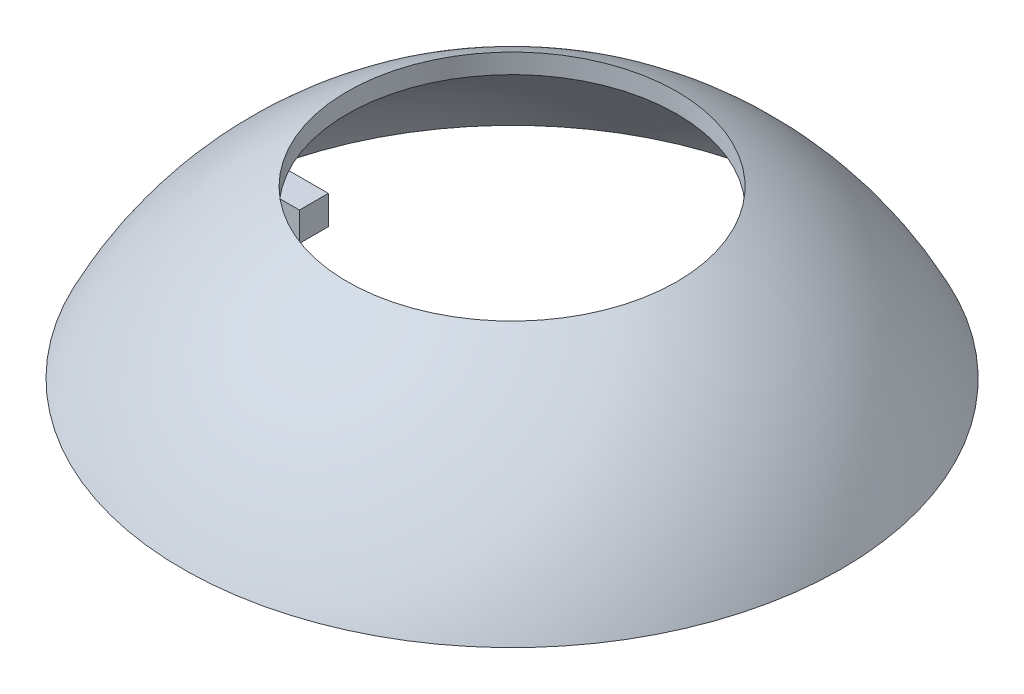
from build123d import *

# Parameters (mm, degrees)
SALIENTE_EXTRUIR1_DEPTH = 5


with BuildPart() as part:
    # Croquis2 → Revolución2 (revolve)
    with BuildSketch(Plane.XY):
        with BuildLine():
            Line((57, 27.986603938), (53.637673328, 27.986603938))
            ThreePointArc((53.637673328, 27.986603938), (42.984719481, 42.574216272), (28.5, 53.366656257))
            Line((28.5, 53.366656257), (28.5, 56.745043836))
            ThreePointArc((28.5, 56.745043836), (45.103486188, 44.698160294), (57, 27.986603938))
        make_face()
    revolve(axis=Axis((0, 10.058437275, 0), (0, 1, 0)))

    # Croquis3 → Saliente-Extruir1 (add)
    with BuildSketch(Plane.XZ.offset(-27.986603938)):
        with BuildLine():
            Line((38.630056924, 1.848931625), (49.379751122, 1.848931625))
            Line((49.379751122, 1.848931625), (49.379751122, -3.151068375))
            Line((49.379751122, -3.151068375), (38.630056924, -3.151068375))
            Line((38.630056924, -3.151068375), (38.630056924, -8.151068375))
            Line((38.630056924, -8.151068375), (53.014715734, -8.151068375))
            ThreePointArc((53.014715734, -8.151068375), (53.633642946, -0.657528958), (53.198610279, 6.848931625))
            Line((53.198610279, 6.848931625), (38.630056924, 6.848931625))
            Line((38.630056924, 6.848931625), (38.630056924, 1.848931625))
        make_face()
        with BuildLine():
            Line((-38.630056924, 8.151068375), (-53.014715734, 8.151068375))
            ThreePointArc((-53.014715734, 8.151068375), (-53.633642946, 0.657528958), (-53.198610279, -6.848931625))
            Line((-53.198610279, -6.848931625), (-38.630056924, -6.848931625))
            Line((-38.630056924, -6.848931625), (-38.630056924, -1.848931625))
            Line((-38.630056924, -1.848931625), (-49.379751122, -1.848931625))
            Line((-49.379751122, -1.848931625), (-49.379751122, 3.151068375))
            Line((-49.379751122, 3.151068375), (-38.630056924, 3.151068375))
            Line((-38.630056924, 3.151068375), (-38.630056924, 8.151068375))
        make_face()
    extrude(amount=-SALIENTE_EXTRUIR1_DEPTH)


solid = part.part
